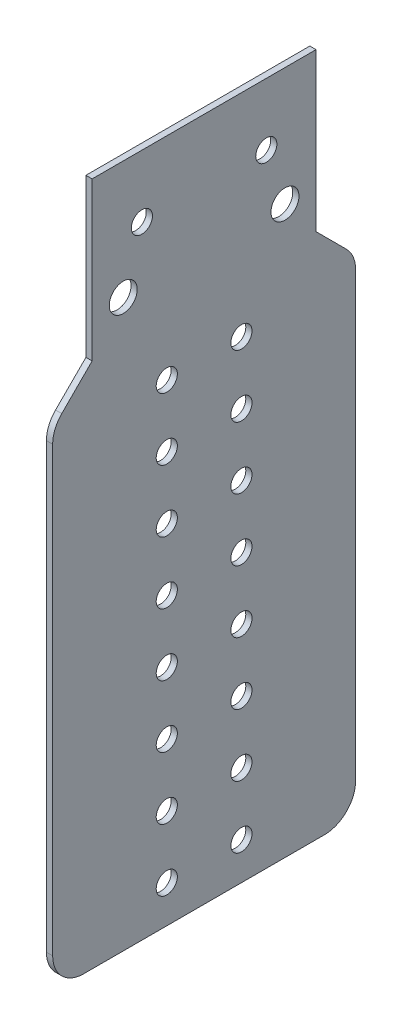
from build123d import *

# Parameters (mm, degrees)
SKETCH1_W            = 36
SKETCH1_H            = 110
BOSS_EXTRUDE1_DEPTH  = 1
M3_CLEARANCE_HOLE1_D = 3.4
M4_CLEARANCE_HOLE1_D = 4.5
M3_CLEARANCE_HOLE2_D = 3.4
BOSS_EXTRUDE2_DEPTH  = 1


with BuildPart() as part:
    # Sketch1 → Boss-Extrude1 (new body)
    with BuildSketch(Plane(origin=(0, 0, 0), x_dir=(0, 0, -1), z_dir=(1, 0, 0))):
        with Locations((0, -55)):
            Rectangle(SKETCH1_W, SKETCH1_H)
    extrude(amount=BOSS_EXTRUDE1_DEPTH)

    # M3 Clearance Hole1 (through all)
    with Locations(Plane.ZY):
        with Locations((-10, -10), (10, -10)):
            Hole(M3_CLEARANCE_HOLE1_D / 2)

    # M4 Clearance Hole1 (through all)
    with Locations(Plane.ZY):
        with Locations((-13, -19), (13, -19)):
            Hole(M4_CLEARANCE_HOLE1_D / 2)

    # M3 Clearance Hole2 (through all)
    with Locations(Plane(origin=(1, 0, 0), x_dir=(0, 0, -1), z_dir=(1, 0, 0))):
        with Locations((6, -104), (-6, -104), (6, -94), (-6, -94), (6, -84), (-6, -84), (6, -74), (-6, -74), (6, -64), (-6, -64), (6, -54), (-6, -54), (6, -44), (-6, -44), (6, -34), (-6, -34)):
            Hole(M3_CLEARANCE_HOLE2_D / 2)

    # Sketch9 → Boss-Extrude2 (add)
    with BuildSketch(Plane.ZY):
        with BuildLine():
            Line((18, -25.35), (22.885533906, -30.235533906))
            ThreePointArc((22.885533906, -30.235533906), (23.969397663, -31.85765065), (24.35, -33.771067812))
            Line((24.35, -33.771067812), (24.35, -105))
            ThreePointArc((24.35, -105), (22.885533906, -108.535533906), (19.35, -110))
            Line((19.35, -110), (18, -110))
            Line((18, -110), (18, -25.35))
        make_face()
        with BuildLine():
            Line((-18, -25.35), (-22.885533906, -30.235533906))
            ThreePointArc((-22.885533906, -30.235533906), (-23.969397663, -31.85765065), (-24.35, -33.771067812))
            Line((-24.35, -33.771067812), (-24.35, -105))
            ThreePointArc((-24.35, -105), (-22.885533906, -108.535533906), (-19.35, -110))
            Line((-19.35, -110), (-18, -110))
            Line((-18, -110), (-18, -25.35))
        make_face()
    extrude(amount=-BOSS_EXTRUDE2_DEPTH)


solid = part.part
